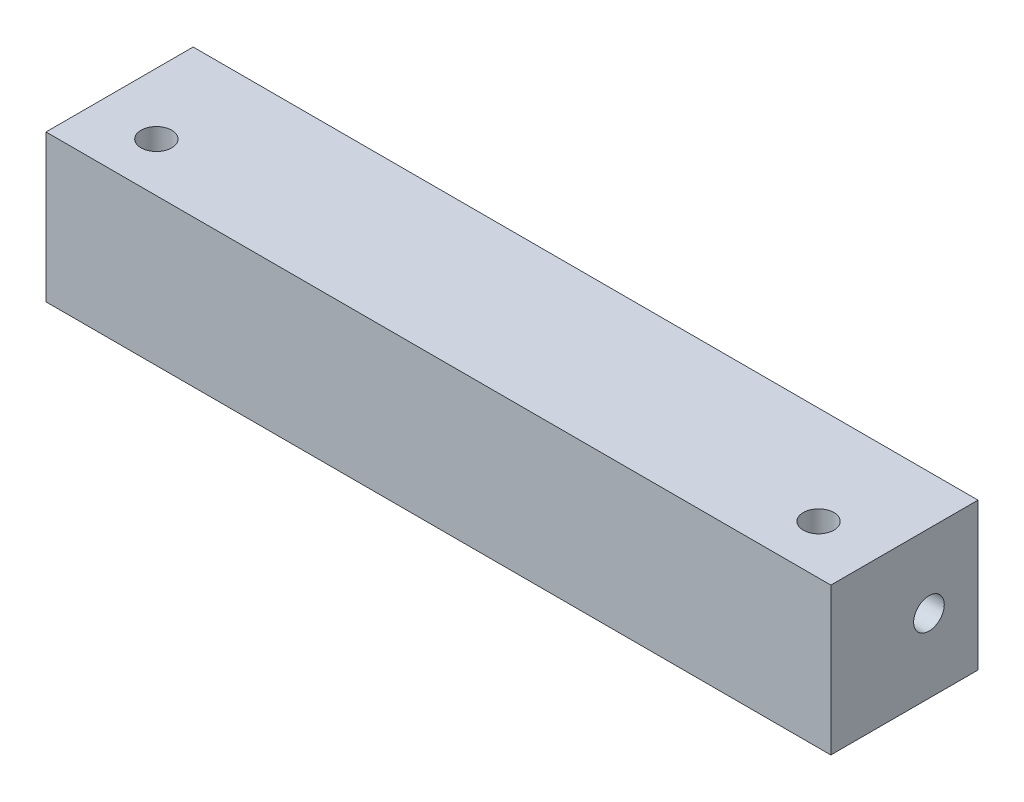
from build123d import *

# Parameters (mm, degrees)
ESQUISSE1_W             = 32
ESQUISSE1_H             = 6
BOSS_EXTRU_1_DEPTH      = 6
ESQUISSE2_R             = 0.625
ENL_V_MAT_EXTRU_1_DEPTH = 34.105890714
ESQUISSE3_R             = 0.625
ENL_V_MAT_EXTRU_2_DEPTH = 34.105890714


with BuildPart() as part:
    # Esquisse1 → Boss.-Extru.1 (new body)
    with BuildSketch(Plane.XY):
        with Locations((16, 3)):
            Rectangle(ESQUISSE1_W, ESQUISSE1_H)
    extrude(amount=BOSS_EXTRU_1_DEPTH)

    # Esquisse2 → Enlèv. mat.-Extru.1 (cut, through all)
    with BuildSketch(Plane(origin=(32, 0, 0), x_dir=(0, 0, -1), z_dir=(1, 0, 0))):
        with Locations((-2, 3)):
            Circle(ESQUISSE2_R)
    extrude(amount=-ENL_V_MAT_EXTRU_1_DEPTH, mode=Mode.SUBTRACT)

    # Esquisse3 → Enlèv. mat.-Extru.2 (cut, through all)
    with BuildSketch(Plane(origin=(0, 6, 0), x_dir=(1, 0, 0), z_dir=(0, 1, 0))):
        with Locations(Location((29.5, -4, 0), (0, 0, 180))):
            Circle(ESQUISSE3_R)
        with Locations(Location((2.5, -4, 0), (0, 0, 180))):
            Circle(ESQUISSE3_R)
    extrude(amount=-ENL_V_MAT_EXTRU_2_DEPTH, mode=Mode.SUBTRACT)


solid = part.part
